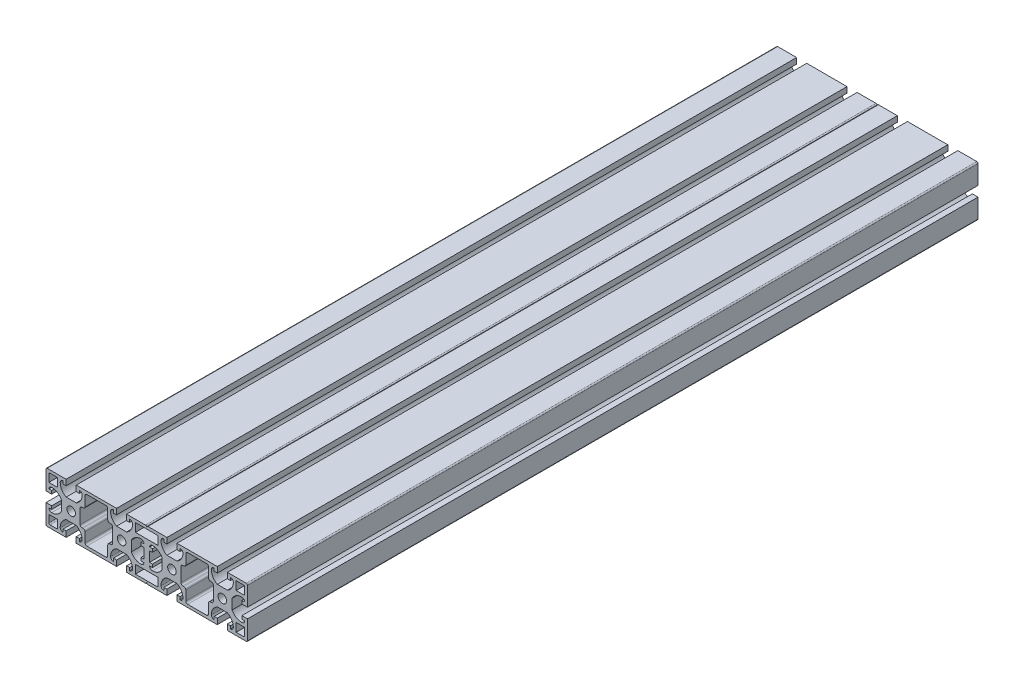
from build123d import *

# Parameters (mm, degrees)
SZKIC1_W                    = 18.057236458
SZKIC1_H                    = 6.778618229
SZKIC1_R                    = 3.4
DODANIE_WYCI_GNI_CIE1_DEPTH = 580


with BuildPart() as part:
    # Szkic1 → Dodanie-wyciągnięcie1 (new body)
    with BuildSketch(Plane.XY):
        with BuildLine():
            ThreePointArc((-41, -20), (-40.292893219, -19.707106781), (-40, -19))
            ThreePointArc((-40, -19), (-39.707106781, -19.707106781), (-39, -20))
            Line((-39, -20), (-24, -20))
            Line((-24, -20), (-24, -15.5))
            Line((-24, -15.5), (-26.471381771, -15.5))
            Line((-26.471381771, -15.5), (-26.471381771, -17.75))
            ThreePointArc((-26.471381771, -17.75), (-28.062372029, -17.090990258), (-28.721381771, -15.5))
            ThreePointArc((-28.721381771, -15.5), (-27.448087912, -10.962546258), (-24, -7.75))
            Line((-24, -7.75), (-16, -7.75))
            ThreePointArc((-16, -7.75), (-12.551912088, -10.962546258), (-11.278618229, -15.5))
            ThreePointArc((-11.278618229, -15.5), (-11.937627971, -17.090990258), (-13.528618229, -17.75))
            Line((-13.528618229, -17.75), (-13.528618229, -15.5))
            Line((-13.528618229, -15.5), (-16, -15.5))
            Line((-16, -15.5), (-16, -20))
            Line((-16, -20), (16, -20))
            Line((16, -20), (16, -15.5))
            Line((16, -15.5), (13.528618229, -15.5))
            Line((13.528618229, -15.5), (13.528618229, -17.75))
            ThreePointArc((13.528618229, -17.75), (11.937627971, -17.090990258), (11.278618229, -15.5))
            ThreePointArc((11.278618229, -15.5), (12.551912088, -10.962546258), (16, -7.75))
            Line((16, -7.75), (24, -7.75))
            ThreePointArc((24, -7.75), (27.448087912, -10.962546258), (28.721381771, -15.5))
            ThreePointArc((28.721381771, -15.5), (28.062372029, -17.090990258), (26.471381771, -17.75))
            Line((26.471381771, -17.75), (26.471381771, -15.5))
            Line((26.471381771, -15.5), (24, -15.5))
            Line((24, -15.5), (24, -20))
            Line((24, -20), (39, -20))
            ThreePointArc((39, -20), (39.707106781, -19.707106781), (40, -19))
            Line((40, -19), (40, -4))
            Line((40, -4), (35.5, -4))
            Line((35.5, -4), (35.5, -6.471381771))
            Line((35.5, -6.471381771), (37.75, -6.471381771))
            ThreePointArc((37.75, -6.471381771), (37.090990258, -8.062372029), (35.5, -8.721381771))
            ThreePointArc((35.5, -8.721381771), (30.962546258, -7.448087912), (27.75, -4))
            Line((27.75, -4), (27.75, 4))
            ThreePointArc((27.75, 4), (30.962546258, 7.448087912), (35.5, 8.721381771))
            ThreePointArc((35.5, 8.721381771), (37.090990258, 8.062372029), (37.75, 6.471381771))
            Line((37.75, 6.471381771), (35.5, 6.471381771))
            Line((35.5, 6.471381771), (35.5, 4))
            Line((35.5, 4), (40, 4))
            Line((40, 4), (40, 19))
            ThreePointArc((40, 19), (39.707106781, 19.707106781), (39, 20))
            Line((39, 20), (24, 20))
            Line((24, 20), (24, 15.5))
            Line((24, 15.5), (26.471381771, 15.5))
            Line((26.471381771, 15.5), (26.471381771, 17.75))
            ThreePointArc((26.471381771, 17.75), (28.062372029, 17.090990258), (28.721381771, 15.5))
            ThreePointArc((28.721381771, 15.5), (27.448087912, 10.962546258), (24, 7.75))
            Line((24, 7.75), (16, 7.75))
            ThreePointArc((16, 7.75), (12.551912088, 10.962546258), (11.278618229, 15.5))
            ThreePointArc((11.278618229, 15.5), (11.937627971, 17.090990258), (13.528618229, 17.75))
            Line((13.528618229, 17.75), (13.528618229, 15.5))
            Line((13.528618229, 15.5), (16, 15.5))
            Line((16, 15.5), (16, 20))
            Line((16, 20), (-16, 20))
            Line((-16, 20), (-16, 15.5))
            Line((-16, 15.5), (-13.528618229, 15.5))
            Line((-13.528618229, 15.5), (-13.528618229, 17.75))
            ThreePointArc((-13.528618229, 17.75), (-11.937627971, 17.090990258), (-11.278618229, 15.5))
            ThreePointArc((-11.278618229, 15.5), (-12.551912088, 10.962546258), (-16, 7.75))
            Line((-16, 7.75), (-24, 7.75))
            ThreePointArc((-24, 7.75), (-27.448087912, 10.962546258), (-28.721381771, 15.5))
            ThreePointArc((-28.721381771, 15.5), (-28.062372029, 17.090990258), (-26.471381771, 17.75))
            Line((-26.471381771, 17.75), (-26.471381771, 15.5))
            Line((-26.471381771, 15.5), (-24, 15.5))
            Line((-24, 15.5), (-24, 20))
            Line((-24, 20), (-39, 20))
            ThreePointArc((-39, 20), (-39.707106781, 19.707106781), (-40, 19))
            ThreePointArc((-40, 19), (-40.292893219, 19.707106781), (-41, 20))
            Line((-41, 20), (-56, 20))
            Line((-56, 20), (-56, 15.5))
            Line((-56, 15.5), (-53.528618229, 15.5))
            Line((-53.528618229, 15.5), (-53.528618229, 17.75))
            ThreePointArc((-53.528618229, 17.75), (-51.937627971, 17.090990258), (-51.278618229, 15.5))
            ThreePointArc((-51.278618229, 15.5), (-52.551912088, 10.962546258), (-56, 7.75))
            Line((-56, 7.75), (-64, 7.75))
            ThreePointArc((-64, 7.75), (-67.448087912, 10.962546258), (-68.721381771, 15.5))
            ThreePointArc((-68.721381771, 15.5), (-68.062372029, 17.090990258), (-66.471381771, 17.75))
            Line((-66.471381771, 17.75), (-66.471381771, 15.5))
            Line((-66.471381771, 15.5), (-64, 15.5))
            Line((-64, 15.5), (-64, 20))
            Line((-64, 20), (-96, 20))
            Line((-96, 20), (-96, 15.5))
            Line((-96, 15.5), (-93.528618229, 15.5))
            Line((-93.528618229, 15.5), (-93.528618229, 17.75))
            ThreePointArc((-93.528618229, 17.75), (-91.937627971, 17.090990258), (-91.278618229, 15.5))
            ThreePointArc((-91.278618229, 15.5), (-92.551912088, 10.962546258), (-96, 7.75))
            Line((-96, 7.75), (-104, 7.75))
            ThreePointArc((-104, 7.75), (-107.448087912, 10.962546258), (-108.721381771, 15.5))
            ThreePointArc((-108.721381771, 15.5), (-108.062372029, 17.090990258), (-106.471381771, 17.75))
            Line((-106.471381771, 17.75), (-106.471381771, 15.5))
            Line((-106.471381771, 15.5), (-104, 15.5))
            Line((-104, 15.5), (-104, 20))
            Line((-104, 20), (-119, 20))
            ThreePointArc((-119, 20), (-119.707106781, 19.707106781), (-120, 19))
            Line((-120, 19), (-120, 4))
            Line((-120, 4), (-115.5, 4))
            Line((-115.5, 4), (-115.5, 6.471381771))
            Line((-115.5, 6.471381771), (-117.75, 6.471381771))
            ThreePointArc((-117.75, 6.471381771), (-117.090990258, 8.062372029), (-115.5, 8.721381771))
            ThreePointArc((-115.5, 8.721381771), (-110.962546258, 7.448087912), (-107.75, 4))
            Line((-107.75, 4), (-107.75, -4))
            ThreePointArc((-107.75, -4), (-110.962546258, -7.448087912), (-115.5, -8.721381771))
            ThreePointArc((-115.5, -8.721381771), (-117.090990258, -8.062372029), (-117.75, -6.471381771))
            Line((-117.75, -6.471381771), (-115.5, -6.471381771))
            Line((-115.5, -6.471381771), (-115.5, -4))
            Line((-115.5, -4), (-120, -4))
            Line((-120, -4), (-120, -19))
            ThreePointArc((-120, -19), (-119.707106781, -19.707106781), (-119, -20))
            Line((-119, -20), (-104, -20))
            Line((-104, -20), (-104, -15.5))
            Line((-104, -15.5), (-106.471381771, -15.5))
            Line((-106.471381771, -15.5), (-106.471381771, -17.75))
            ThreePointArc((-106.471381771, -17.75), (-108.062372029, -17.090990258), (-108.721381771, -15.5))
            ThreePointArc((-108.721381771, -15.5), (-107.448087912, -10.962546258), (-104, -7.75))
            Line((-104, -7.75), (-96, -7.75))
            ThreePointArc((-96, -7.75), (-92.551912088, -10.962546258), (-91.278618229, -15.5))
            ThreePointArc((-91.278618229, -15.5), (-91.937627971, -17.090990258), (-93.528618229, -17.75))
            Line((-93.528618229, -17.75), (-93.528618229, -15.5))
            Line((-93.528618229, -15.5), (-96, -15.5))
            Line((-96, -15.5), (-96, -20))
            Line((-96, -20), (-64, -20))
            Line((-64, -20), (-64, -15.5))
            Line((-64, -15.5), (-66.471381771, -15.5))
            Line((-66.471381771, -15.5), (-66.471381771, -17.75))
            ThreePointArc((-66.471381771, -17.75), (-68.062372029, -17.090990258), (-68.721381771, -15.5))
            ThreePointArc((-68.721381771, -15.5), (-67.448087912, -10.962546258), (-64, -7.75))
            Line((-64, -7.75), (-56, -7.75))
            ThreePointArc((-56, -7.75), (-52.551912088, -10.962546258), (-51.278618229, -15.5))
            ThreePointArc((-51.278618229, -15.5), (-51.937627971, -17.090990258), (-53.528618229, -17.75))
            Line((-53.528618229, -17.75), (-53.528618229, -15.5))
            Line((-53.528618229, -15.5), (-56, -15.5))
            Line((-56, -15.5), (-56, -20))
            Line((-56, -20), (-41, -20))
        make_face()
        with Locations((-40, 14.360690886)):
            Rectangle(SZKIC1_W, SZKIC1_H, mode=Mode.SUBTRACT)
        with Locations((-40, -14.360690886)):
            Rectangle(SZKIC1_W, SZKIC1_H, mode=Mode.SUBTRACT)
        with BuildLine():
            Line((-117.75, -10.971381771), (-110.971381771, -10.971381771))
            Line((-110.971381771, -10.971381771), (-110.971381771, -17.75))
            Line((-110.971381771, -17.75), (-116.75, -17.75))
            ThreePointArc((-116.75, -17.75), (-117.457106781, -17.457106781), (-117.75, -16.75))
            Line((-117.75, -16.75), (-117.75, -10.971381771))
        make_face(mode=Mode.SUBTRACT)
        with BuildLine():
            ThreePointArc((-89.028618229, -8.590188806), (-89.467958057, -7.529528634), (-90.528618229, -7.090188806))
            Line((-90.528618229, -7.090188806), (-91.40950808, -7.090188806))
            ThreePointArc((-91.40950808, -7.090188806), (-92.470168251, -6.650848977), (-92.90950808, -5.590188806))
            Line((-92.90950808, -5.590188806), (-92.90950808, 5.590188806))
            ThreePointArc((-92.90950808, 5.590188806), (-92.470168251, 6.650848977), (-91.40950808, 7.090188806))
            Line((-91.40950808, 7.090188806), (-90.528618229, 7.090188806))
            ThreePointArc((-90.528618229, 7.090188806), (-89.467958057, 7.529528634), (-89.028618229, 8.590188806))
            Line((-89.028618229, 8.590188806), (-89.028618229, 16.25))
            ThreePointArc((-89.028618229, 16.25), (-88.589278401, 17.310660172), (-87.528618229, 17.75))
            Line((-87.528618229, 17.75), (-72.471381771, 17.75))
            ThreePointArc((-72.471381771, 17.75), (-71.410721599, 17.310660172), (-70.971381771, 16.25))
            Line((-70.971381771, 16.25), (-70.971381771, 8.590188806))
            ThreePointArc((-70.971381771, 8.590188806), (-70.532041943, 7.529528634), (-69.471381771, 7.090188806))
            Line((-69.471381771, 7.090188806), (-68.59049192, 7.090188806))
            ThreePointArc((-68.59049192, 7.090188806), (-67.529831749, 6.650848977), (-67.09049192, 5.590188806))
            Line((-67.09049192, 5.590188806), (-67.09049192, -5.590188806))
            ThreePointArc((-67.09049192, -5.590188806), (-67.529831749, -6.650848977), (-68.59049192, -7.090188806))
            Line((-68.59049192, -7.090188806), (-69.471381771, -7.090188806))
            ThreePointArc((-69.471381771, -7.090188806), (-70.532041943, -7.529528634), (-70.971381771, -8.590188806))
            Line((-70.971381771, -8.590188806), (-70.971381771, -16.25))
            ThreePointArc((-70.971381771, -16.25), (-71.410721599, -17.310660172), (-72.471381771, -17.75))
            Line((-72.471381771, -17.75), (-87.528618229, -17.75))
            ThreePointArc((-87.528618229, -17.75), (-88.589278401, -17.310660172), (-89.028618229, -16.25))
            Line((-89.028618229, -16.25), (-89.028618229, -8.590188806))
        make_face(mode=Mode.SUBTRACT)
        with BuildLine():
            Line((-44.5, 4), (-42.25, 4))
            Line((-42.25, 4), (-42.25, -4))
            Line((-42.25, -4), (-44.5, -4))
            Line((-44.5, -4), (-44.5, -6.471381771))
            Line((-44.5, -6.471381771), (-42.25, -6.471381771))
            ThreePointArc((-42.25, -6.471381771), (-42.909009742, -8.062372029), (-44.5, -8.721381771))
            ThreePointArc((-44.5, -8.721381771), (-49.037453742, -7.448087912), (-52.25, -4))
            Line((-52.25, -4), (-52.25, 4))
            ThreePointArc((-52.25, 4), (-49.037453742, 7.448087912), (-44.5, 8.721381771))
            ThreePointArc((-44.5, 8.721381771), (-42.909009742, 8.062372029), (-42.25, 6.471381771))
            Line((-42.25, 6.471381771), (-44.5, 6.471381771))
            Line((-44.5, 6.471381771), (-44.5, 4))
        make_face(mode=Mode.SUBTRACT)
        with Locations((-100, 0)):
            Circle(SZKIC1_R, mode=Mode.SUBTRACT)
        with Locations((-60, 0)):
            Circle(SZKIC1_R, mode=Mode.SUBTRACT)
        with BuildLine():
            Line((-110.971381771, 10.971381771), (-117.75, 10.971381771))
            Line((-117.75, 10.971381771), (-117.75, 16.75))
            ThreePointArc((-117.75, 16.75), (-117.457106781, 17.457106781), (-116.75, 17.75))
            Line((-116.75, 17.75), (-110.971381771, 17.75))
            Line((-110.971381771, 17.75), (-110.971381771, 10.971381771))
        make_face(mode=Mode.SUBTRACT)
        with BuildLine():
            ThreePointArc((36.75, 17.75), (37.457106781, 17.457106781), (37.75, 16.75))
            Line((37.75, 16.75), (37.75, 10.971381771))
            Line((37.75, 10.971381771), (30.971381771, 10.971381771))
            Line((30.971381771, 10.971381771), (30.971381771, 17.75))
            Line((30.971381771, 17.75), (36.75, 17.75))
        make_face(mode=Mode.SUBTRACT)
        with BuildLine():
            Line((36.75, -17.75), (30.971381771, -17.75))
            Line((30.971381771, -17.75), (30.971381771, -10.971381771))
            Line((30.971381771, -10.971381771), (37.75, -10.971381771))
            Line((37.75, -10.971381771), (37.75, -16.75))
            ThreePointArc((37.75, -16.75), (37.457106781, -17.457106781), (36.75, -17.75))
        make_face(mode=Mode.SUBTRACT)
        with BuildLine():
            Line((-37.75, -6.471381771), (-35.5, -6.471381771))
            Line((-35.5, -6.471381771), (-35.5, -4))
            Line((-35.5, -4), (-37.75, -4))
            Line((-37.75, -4), (-37.75, 4))
            Line((-37.75, 4), (-35.5, 4))
            Line((-35.5, 4), (-35.5, 6.471381771))
            Line((-35.5, 6.471381771), (-37.75, 6.471381771))
            ThreePointArc((-37.75, 6.471381771), (-37.090990258, 8.062372029), (-35.5, 8.721381771))
            ThreePointArc((-35.5, 8.721381771), (-30.962546258, 7.448087912), (-27.75, 4))
            Line((-27.75, 4), (-27.75, -4))
            ThreePointArc((-27.75, -4), (-30.962546258, -7.448087912), (-35.5, -8.721381771))
            ThreePointArc((-35.5, -8.721381771), (-37.090990258, -8.062372029), (-37.75, -6.471381771))
        make_face(mode=Mode.SUBTRACT)
        with BuildLine():
            ThreePointArc((9.028618229, 8.590188806), (9.467958057, 7.529528634), (10.528618229, 7.090188806))
            Line((10.528618229, 7.090188806), (11.40950808, 7.090188806))
            ThreePointArc((11.40950808, 7.090188806), (12.470168251, 6.650848977), (12.90950808, 5.590188806))
            Line((12.90950808, 5.590188806), (12.90950808, -5.590188806))
            ThreePointArc((12.90950808, -5.590188806), (12.470168251, -6.650848977), (11.40950808, -7.090188806))
            Line((11.40950808, -7.090188806), (10.528618229, -7.090188806))
            ThreePointArc((10.528618229, -7.090188806), (9.467958057, -7.529528634), (9.028618229, -8.590188806))
            Line((9.028618229, -8.590188806), (9.028618229, -16.25))
            ThreePointArc((9.028618229, -16.25), (8.589278401, -17.310660172), (7.528618229, -17.75))
            Line((7.528618229, -17.75), (-7.528618229, -17.75))
            ThreePointArc((-7.528618229, -17.75), (-8.589278401, -17.310660172), (-9.028618229, -16.25))
            Line((-9.028618229, -16.25), (-9.028618229, -8.590188806))
            ThreePointArc((-9.028618229, -8.590188806), (-9.467958057, -7.529528634), (-10.528618229, -7.090188806))
            Line((-10.528618229, -7.090188806), (-11.40950808, -7.090188806))
            ThreePointArc((-11.40950808, -7.090188806), (-12.470168251, -6.650848977), (-12.90950808, -5.590188806))
            Line((-12.90950808, -5.590188806), (-12.90950808, 5.590188806))
            ThreePointArc((-12.90950808, 5.590188806), (-12.470168251, 6.650848977), (-11.40950808, 7.090188806))
            Line((-11.40950808, 7.090188806), (-10.528618229, 7.090188806))
            ThreePointArc((-10.528618229, 7.090188806), (-9.467958057, 7.529528634), (-9.028618229, 8.590188806))
            Line((-9.028618229, 8.590188806), (-9.028618229, 16.25))
            ThreePointArc((-9.028618229, 16.25), (-8.589278401, 17.310660172), (-7.528618229, 17.75))
            Line((-7.528618229, 17.75), (7.528618229, 17.75))
            ThreePointArc((7.528618229, 17.75), (8.589278401, 17.310660172), (9.028618229, 16.25))
            Line((9.028618229, 16.25), (9.028618229, 8.590188806))
        make_face(mode=Mode.SUBTRACT)
        with Locations((-20, 0)):
            Circle(SZKIC1_R, mode=Mode.SUBTRACT)
        with Locations((20, 0)):
            Circle(SZKIC1_R, mode=Mode.SUBTRACT)
    extrude(amount=DODANIE_WYCI_GNI_CIE1_DEPTH)


solid = part.part
